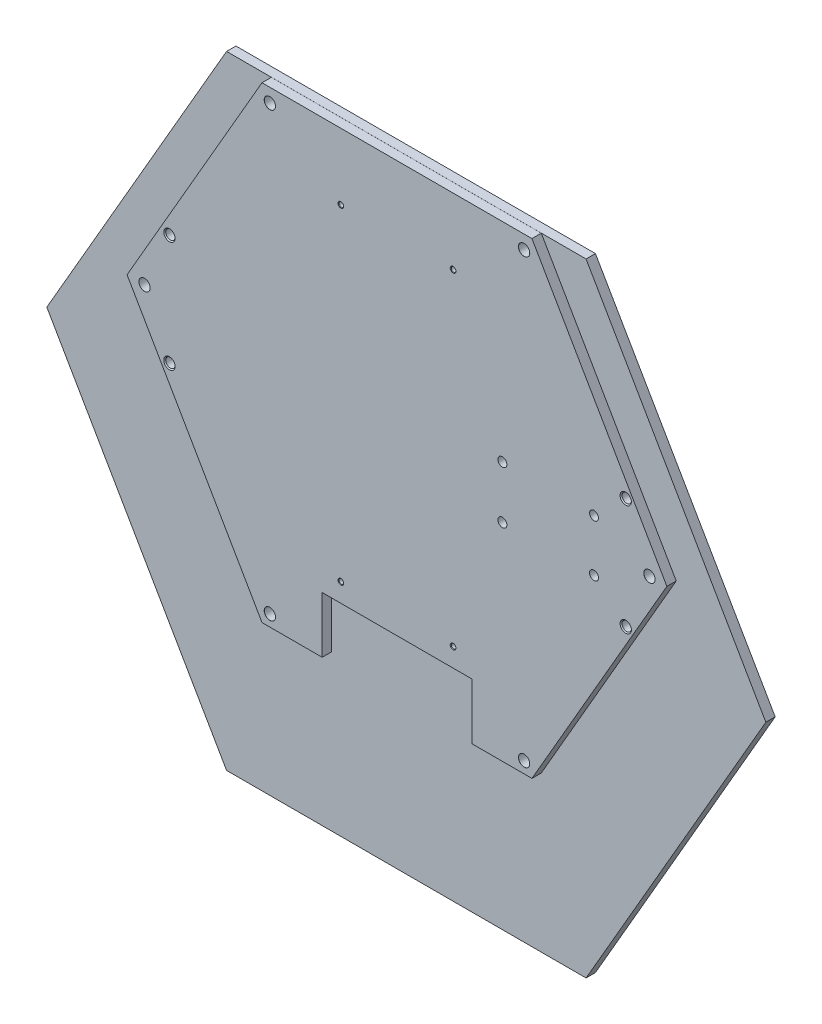
from build123d import *

# Parameters (mm, degrees)
EXTRUDE_3_DEPTH                 = 5
HOLE_WIZARD_M3_1_D              = 2.5
HOLE_WIZARD_M3_1_CSINK_D        = 3.05
HOLE_WIZARD_M3_1_CSINK_ANGLE    = 90
HOLE_WIZARD_M3_2_D              = 2.5
HOLE_WIZARD_M3_2_CSINK_D        = 3.05
HOLE_WIZARD_M3_2_CSINK_ANGLE    = 90
HOLE_WIZARD_6_0_6_1_D           = 6
HOLE_WIZARD_6_0_6_1_CSINK_D     = 6.05
HOLE_WIZARD_6_0_6_1_CSINK_ANGLE = 90
SKETCH_20_R                     = 2.4
CUT_EXTRUDE_2_DEPTH             = 192.006108105
HOLE_WIZARD_M6_2_D              = 5
HOLE_WIZARD_M6_2_CSINK_D        = 6.05
HOLE_WIZARD_M6_2_CSINK_ANGLE    = 90
EXTRUDE_5_DEPTH                 = 5
HOLE_WIZARD_M6_3_D              = 5
HOLE_WIZARD_M6_3_CSINK_D        = 6.05
HOLE_WIZARD_M6_3_CSINK_ANGLE    = 90


with BuildPart() as part:
    # 草图8 → 凸台-拉伸3 (new body)
    with BuildSketch(Plane.XY):
        Polygon((144.337567297, 0), (72.168783649, 125), (-72.168783649, 125), (-144.337567297, 0), (-72.168783649, -125), (-40, -125), (-40, -95), (40, -95), (40, -125), (72.168783649, -125), align=None)
    extrude(amount=EXTRUDE_3_DEPTH)

    # M3 螺纹孔1 (through all)
    with Locations(Plane.XY.offset(5)):
        with Locations((-30, -85)):
            hole_wizard_m3_1 = CounterSinkHole(HOLE_WIZARD_M3_1_D / 2, HOLE_WIZARD_M3_1_CSINK_D / 2, counter_sink_angle=HOLE_WIZARD_M3_1_CSINK_ANGLE)

    # M3 螺纹孔2 (through all)
    with Locations(Plane.XY.offset(5)):
        with Locations((-30, 89.511250681)):
            hole_wizard_m3_2 = CounterSinkHole(HOLE_WIZARD_M3_2_D / 2, HOLE_WIZARD_M3_2_CSINK_D / 2, counter_sink_angle=HOLE_WIZARD_M3_2_CSINK_ANGLE)

    # 镜向1: M3 螺纹孔1, M3 螺纹孔2 across plane
    add(hole_wizard_m3_1.mirror(Plane(origin=(0, 0, 0), x_dir=(0, 0, 1), z_dir=(1, 0, 0))), mode=Mode.SUBTRACT)
    add(hole_wizard_m3_2.mirror(Plane(origin=(0, 0, 0), x_dir=(0, 0, 1), z_dir=(1, 0, 0))), mode=Mode.SUBTRACT)

    # Ø6.0 (6) 直径孔1 (through all)
    with Locations(Plane.XY.offset(5)):
        with Locations((-135.003092598, 0), (-67.980688817, -118.866778441), (-67.980688817, 117.662022204)):
            hole_wizard_6_0_6_1 = CounterSinkHole(HOLE_WIZARD_6_0_6_1_D / 2, HOLE_WIZARD_6_0_6_1_CSINK_D / 2, counter_sink_angle=HOLE_WIZARD_6_0_6_1_CSINK_ANGLE)

    # 镜向2: Ø6.0 (6) 直径孔1 across plane
    add(hole_wizard_6_0_6_1.mirror(Plane(origin=(0, 0, 0), x_dir=(0, 0, 1), z_dir=(1, 0, 0))), mode=Mode.SUBTRACT)

    # 草图20 → 切除-拉伸2 (cut, through all)
    with BuildSketch(Plane.XY.offset(5)):
        with Locations((56.370867728, 13.653021969)):
            Circle(SKETCH_20_R)
        with Locations((105.370867728, 13.324633606)):
            Circle(SKETCH_20_R)
        with Locations((56.370867728, -14.346978031)):
            Circle(SKETCH_20_R)
        with Locations((105.370867728, -14.346978031)):
            Circle(SKETCH_20_R)
    extrude(amount=-CUT_EXTRUDE_2_DEPTH, mode=Mode.SUBTRACT)

    # M6 螺纹孔2 (through all)
    with Locations(Plane.XY.offset(5)):
        with Locations((-121.691346762, -29.681796734), (122.33153109, -29.681796734), (-121.691346762, 29.648282418), (122.33153109, 29.648282418)):
            CounterSinkHole(HOLE_WIZARD_M6_2_D / 2, HOLE_WIZARD_M6_2_CSINK_D / 2, counter_sink_angle=HOLE_WIZARD_M6_2_CSINK_ANGLE)

    # 草图28 → 凸台-拉伸5 (add)
    with BuildSketch(Plane.XY):
        Polygon((192.254989682, -41.465529773), (96.127494841, 125.032175296), (-96.127494841, 125.032175296), (-192.254989682, -41.465529773), (-96.127494841, -207.963234842), (96.127494841, -207.963234842), align=None)
    extrude(amount=-EXTRUDE_5_DEPTH)

    # M6 螺纹孔3 (through all)
    with Locations(Plane.XY.offset(5)):
        with Locations((-121.691346762, 29.648282418), (-135.003092598, 0), (-121.691346762, -29.681796734), (122.33153109, 29.648282418), (135.003092598, 0), (122.33153109, -29.681796734), (67.980688817, -118.866778441), (-67.980688817, -118.866778441), (67.980688817, 117.662022204), (-67.980688817, 117.662022204)):
            CounterSinkHole(HOLE_WIZARD_M6_3_D / 2, HOLE_WIZARD_M6_3_CSINK_D / 2, counter_sink_angle=HOLE_WIZARD_M6_3_CSINK_ANGLE)


solid = part.part
